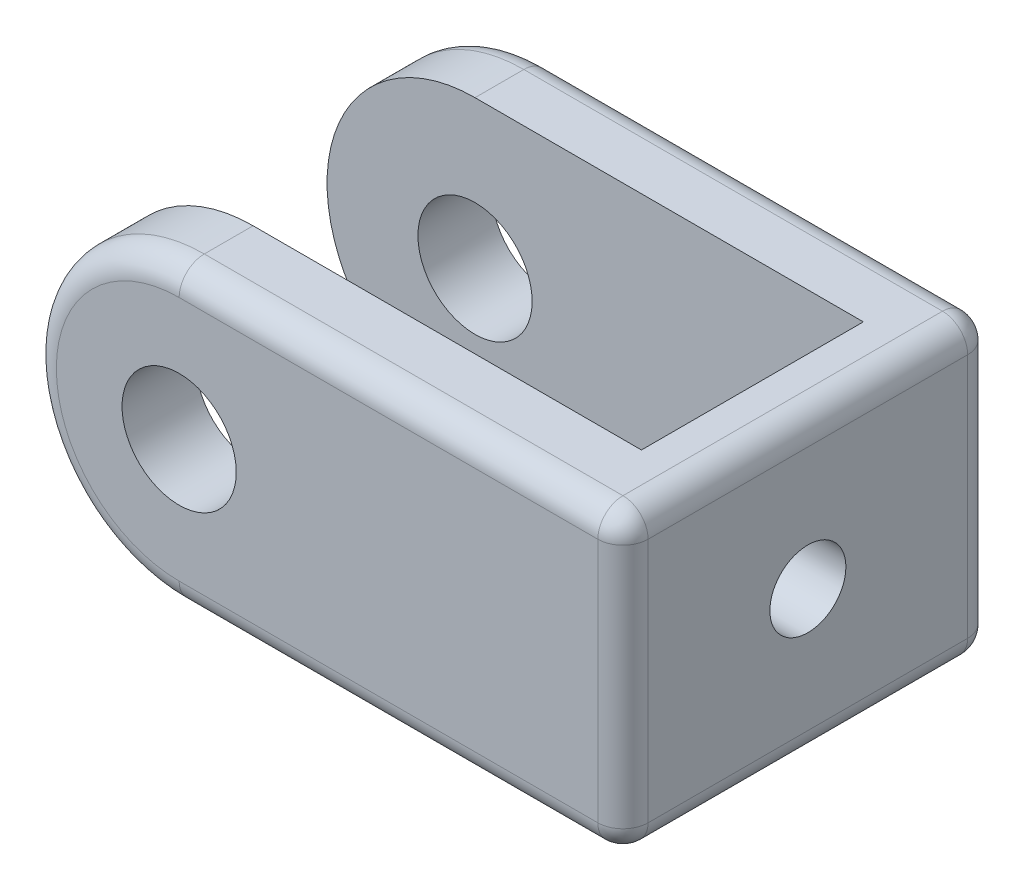
from build123d import *

# Parameters (mm, degrees)
BOSS_EXTRUDE1_DEPTH = 15.875
SKETCH3_R           = 4.9022
CUT_EXTRUDE1_DEPTH  = 47.6627796
SKETCH4_W           = 46.0375
SKETCH4_H           = 19.05
CUT_EXTRUDE2_DEPTH  = 44.649033494
SKETCH5_R           = 3.2639
CUT_EXTRUDE3_DEPTH  = 4.7625
FILLET1_R           = 2.159


with BuildPart() as part:
    # Sketch1 → Boss-Extrude1 (new, symmetric)
    with BuildSketch(Plane.XY):
        with BuildLine():
            Line((-19.05, 12.7), (19.05, 12.7))
            Line((19.05, 12.7), (19.05, -12.7))
            Line((19.05, -12.7), (-19.05, -12.7))
            ThreePointArc((-19.05, -12.7), (-31.75, 0), (-19.05, 12.7))
        make_face()
    extrude(amount=BOSS_EXTRUDE1_DEPTH, both=True)

    # Sketch3 → Cut-Extrude1 (cut, through all)
    with BuildSketch(Plane.XY.offset(15.875)):
        with Locations((-19.05, 0)):
            Circle(SKETCH3_R)
    extrude(amount=-CUT_EXTRUDE1_DEPTH, mode=Mode.SUBTRACT)

    # Sketch4 → Cut-Extrude2 (cut, through all)
    with BuildSketch(Plane(origin=(0, 12.7, 0), x_dir=(1, 0, 0), z_dir=(0, 1, 0))):
        with Locations((-8.73125, 0)):
            Rectangle(SKETCH4_W, SKETCH4_H)
    extrude(amount=-CUT_EXTRUDE2_DEPTH, mode=Mode.SUBTRACT)

    # Sketch5 → Cut-Extrude3 (cut)
    with BuildSketch(Plane(origin=(19.05, 0, 0), x_dir=(0, 0, -1), z_dir=(1, 0, 0))):
        Circle(SKETCH5_R)
    extrude(amount=-CUT_EXTRUDE3_DEPTH, mode=Mode.SUBTRACT)

    # Fillet1
    fillet1_edges = [part.edges().sort_by_distance(p)[0] for p in [
        (19.05, 0, 15.875),
        (0, 12.7, 15.875),
        (-31.75, 0, 15.875),
        (0, 12.7, -15.875),
        (19.05, 0, -15.875),
        (0, -12.7, -15.875),
        (-31.75, 0, -15.875),
        (19.05, 12.7, 0),
        (19.05, -12.7, 0),
        (0, -12.7, 15.875),
    ]]
    fillet(fillet1_edges, radius=FILLET1_R)


solid = part.part
